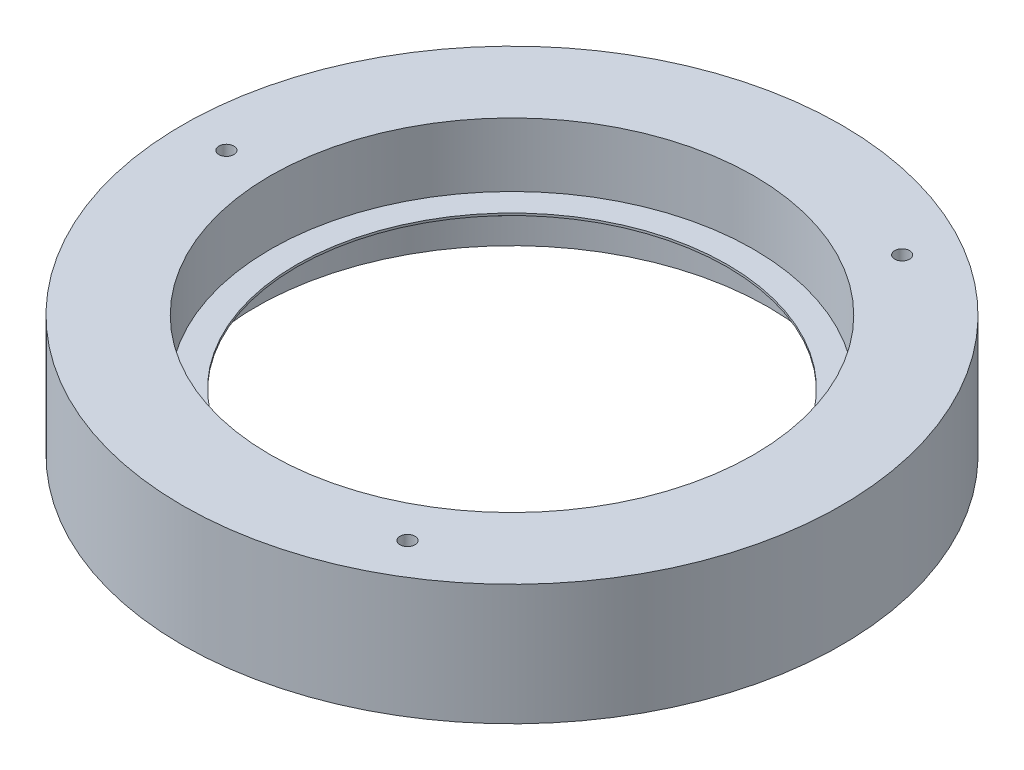
from build123d import *

# Parameters (mm, degrees)
CROQUIS2_R            = 1.7
CORTAR_EXTRUIR1_DEPTH = 59
MATRIZC1_COUNT        = 3


with BuildPart() as part:
    # Croquis1 → Revolución1 (revolve)
    with BuildSketch(Plane.XY, mode=Mode.PRIVATE) as revoluci_n1_sk:
        Polygon((58.282962044, 6), (58.282962044, 0), (75, 0), (75, 27.5), (55, 27.5), (55, 13), (49, 13), (49, 12.5), align=None)
    revolve(revoluci_n1_sk.sketch.rotate(Axis((0, 0, 0), (0, 1, 0)), 90), axis=Axis((0, 0, 0), (0, 1, 0)))

    # Croquis2 → Cortar-Extruir1 (cut)
    with BuildSketch(Plane(origin=(0, 27.5, 0), x_dir=(1, 0, 0), z_dir=(0, 1, 0))):
        with Locations(Location((-65, 0, 0), (0, 0, 270))):
            Circle(CROQUIS2_R)
    cortar_extruir1 = extrude(amount=-CORTAR_EXTRUIR1_DEPTH, mode=Mode.SUBTRACT)

    # MatrizC1: Cortar-Extruir1 ×3 about axis
    matrizc1_axis = Axis((0, 0, 0), (0, 1, 0))
    for i in range(1, MATRIZC1_COUNT):
        add(cortar_extruir1.rotate(matrizc1_axis, i * 360 / MATRIZC1_COUNT), mode=Mode.SUBTRACT)


solid = part.part
